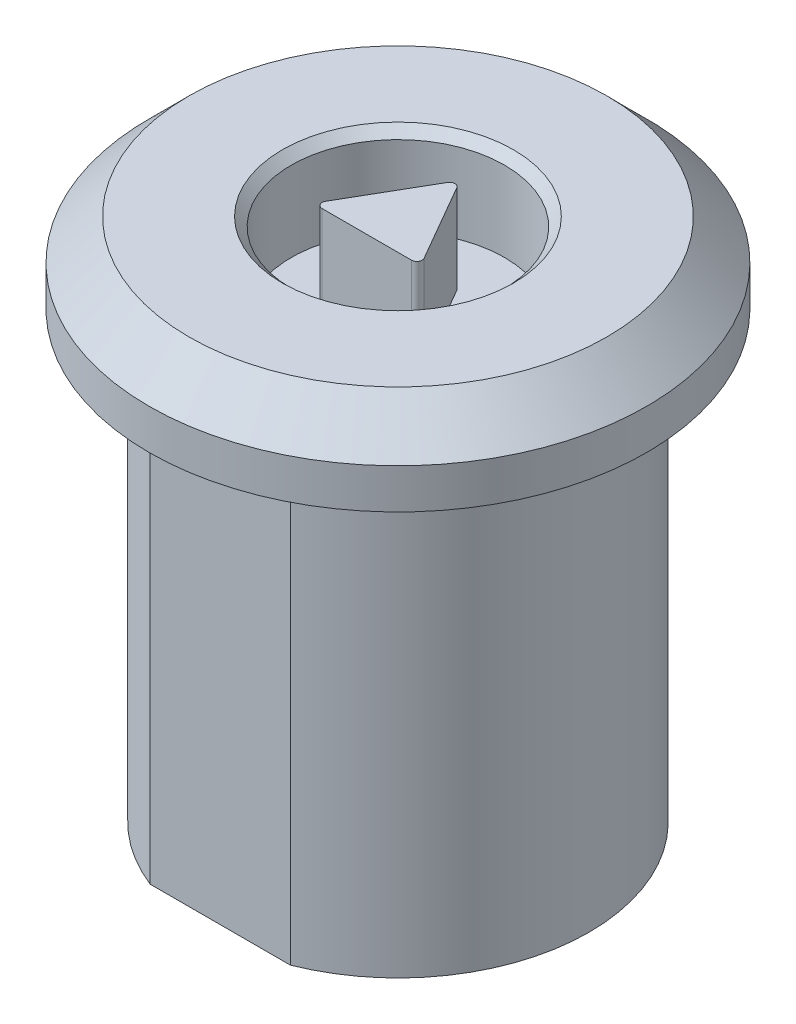
from build123d import *

# Parameters (mm, degrees)
SKETCH_1_R          = 14
EXTRUDE_1_DEPTH     = 4.5
CHAMFER_1_SIZE      = 2.25
SKETCH_2_R          = 10.75
EXTRUDE_2_DEPTH     = 25
CUT_EXTRUDE_START   = -25
CUT_EXTRUDE_1_DEPTH = 25
SKETCH_4_R          = 6
CUT_EXTRUDE_2_DEPTH = 5
EXTRUDE_3_DEPTH     = 5
CHAMFER_2_SIZE      = 0.5
EXTRUDE_4_DEPTH     = 3
SKETCH_7_R          = 2.5
CUT_EXTRUDE_3_DEPTH = 10


with BuildPart() as part:
    # 草图1 → 凸台-拉伸1 (new body)
    with BuildSketch(Plane(origin=(0, 0, 0), x_dir=(1, 0, 0), z_dir=(0, 1, 0))):
        with Locations(Location((0, 0, 0), (0, 0, 270))):
            Circle(SKETCH_1_R)
    extrude(amount=EXTRUDE_1_DEPTH)

    # 倒角1
    chamfer_1_edges = [part.edges().sort_by_distance(p)[0] for p in [
        (0, 4.5, -14),
    ]]
    chamfer(chamfer_1_edges, length=CHAMFER_1_SIZE)

    # 草图2 → 凸台-拉伸2 (add)
    with BuildSketch(Plane.XZ):
        with Locations(Location((0, 0, 0), (0, 0, 90))):
            Circle(SKETCH_2_R)
    extrude(amount=EXTRUDE_2_DEPTH)

    # 草图3 → 切除-拉伸1 (cut)
    with BuildSketch(Plane.XZ.offset(25).offset(CUT_EXTRUDE_START)):
        with BuildLine():
            Line((-3.94493346, -10), (3.94493346, -10))
            ThreePointArc((3.94493346, -10), (0, -10.75), (-3.94493346, -10))
        make_face()
        with BuildLine():
            Line((-3.94493346, 10), (3.94493346, 10))
            ThreePointArc((3.94493346, 10), (0, 10.75), (-3.94493346, 10))
        make_face()
    extrude(amount=CUT_EXTRUDE_1_DEPTH, mode=Mode.SUBTRACT)

    # 草图4 → 切除-拉伸2 (cut)
    with BuildSketch(Plane(origin=(0, 4.5, 0), x_dir=(1, 0, 0), z_dir=(0, 1, 0))):
        with Locations(Location((0, 0, 0), (0, 0, 270))):
            Circle(SKETCH_4_R)
    extrude(amount=-CUT_EXTRUDE_2_DEPTH, mode=Mode.SUBTRACT)

    # 草图5 → 凸台-拉伸3 (add)
    with BuildSketch(Plane(origin=(0, -0.5, 0), x_dir=(1, 0, 0), z_dir=(0, 1, 0))):
        with BuildLine():
            Line((-0.259807621, 3.05), (-2.771281292, -1.3))
            ThreePointArc((-2.771281292, -1.3), (-2.771281292, -1.6), (-2.511473671, -1.75))
            Line((-2.511473671, -1.75), (2.511473671, -1.75))
            ThreePointArc((2.511473671, -1.75), (2.771281292, -1.6), (2.771281292, -1.3))
            Line((2.771281292, -1.3), (0.259807621, 3.05))
            ThreePointArc((0.259807621, 3.05), (0, 3.2), (-0.259807621, 3.05))
        make_face()
    extrude(amount=EXTRUDE_3_DEPTH)

    # 倒角2
    chamfer_2_edges = [part.edges().sort_by_distance(p)[0] for p in [
        (0, 4.5, -6),
    ]]
    chamfer(chamfer_2_edges, length=CHAMFER_2_SIZE)

    # 草图6 → 凸台-拉伸4 (add)
    with BuildSketch(Plane.XZ.offset(25)):
        Polygon((7.071067812, 0), (0, 7.071067812), (-7.071067812, 0), (0, -7.071067812), align=None)
    extrude(amount=EXTRUDE_4_DEPTH)

    # 草图7 → 切除-拉伸3 (cut)
    with BuildSketch(Plane.XZ.offset(28)):
        with Locations(Location((0, 0, 0), (0, 0, 270))):
            Circle(SKETCH_7_R)
    extrude(amount=-CUT_EXTRUDE_3_DEPTH, mode=Mode.SUBTRACT)

    # 草图9 → 切除-旋转3 (revolve, cut)
    with BuildSketch(Plane.XY):
        Polygon((-7.071067812, -27.422649731), (-7.071067812, -28), (-6.071067812, -28), align=None)
    revolve(axis=Axis((0, 0, 0), (0, -1, 0)), mode=Mode.SUBTRACT)


solid = part.part
